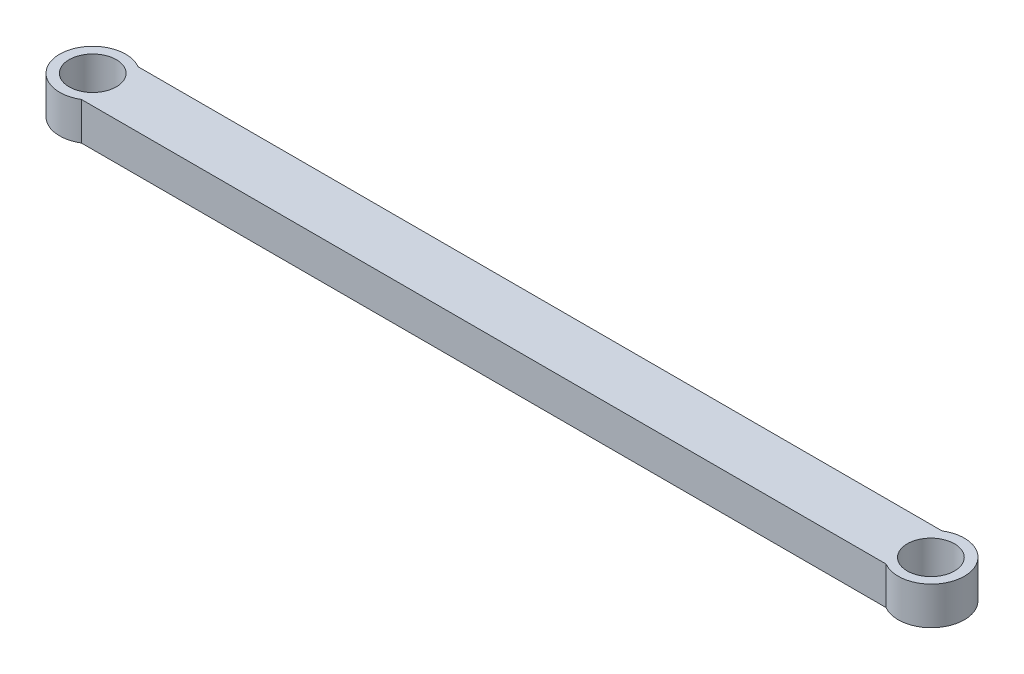
from build123d import *

# Parameters (mm, degrees)
BOSS_EXTRUDE1_DEPTH = 2


with BuildPart() as part:
    # Sketch2 → Boss-Extrude1 (new body)
    with BuildSketch(Plane(origin=(0, 0, 0), x_dir=(1, 0, 0), z_dir=(0, 1, 0))):
        with BuildLine():
            Line((43.464851994, 1.5), (0.901387819, 1.5))
            ThreePointArc((0.901387819, 1.5), (1.523142916, 0.861705088), (1.75, 0))
            ThreePointArc((1.75, 0), (1.523142916, -0.861705088), (0.901387819, -1.5))
            Line((0.901387819, -1.5), (43.499845541, -1.5))
            ThreePointArc((43.499845541, -1.5), (42.633624493, -0.009899958), (43.464851994, 1.5))
        make_face()
        with BuildLine():
            Line((0.901387819, 1.5), (0, 1.5))
            Line((0, 1.5), (0, 1.25))
            ThreePointArc((0, 1.25), (0.883883476, 0.883883476), (1.25, 0))
            ThreePointArc((1.25, 0), (0.883883476, -0.883883476), (0, -1.25))
            Line((0, -1.25), (0, -1.5))
            Line((0, -1.5), (0.901387819, -1.5))
            ThreePointArc((0.901387819, -1.5), (1.523142916, -0.861705088), (1.75, 0))
            ThreePointArc((1.75, 0), (1.523142916, 0.861705088), (0.901387819, 1.5))
        make_face()
        with BuildLine():
            Line((0, 1.5), (0, 1.75))
            ThreePointArc((0, 1.75), (-1.75, 0), (0, -1.75))
            Line((0, -1.75), (0, -1.5))
            Line((0, -1.5), (0, -1.25))
            ThreePointArc((0, -1.25), (-1.25, 0), (0, 1.25))
            Line((0, 1.25), (0, 1.5))
        make_face()
        with BuildLine():
            Line((44.383505452, 1.760511556), (44.383505452, 1.5))
            Line((44.383505452, 1.5), (44.383505452, 1.239488444))
            ThreePointArc((44.383505452, 1.239488444), (45.267388929, 0.87337192), (45.633505452, -0.010511556))
            ThreePointArc((45.633505452, -0.010511556), (45.267388929, -0.894395033), (44.383505452, -1.260511556))
            Line((44.383505452, -1.260511556), (44.383505452, -1.5))
            Line((44.383505452, -1.5), (44.383505452, -1.739488444))
            ThreePointArc((44.383505452, -1.739488444), (45.620942319, -1.226925311), (46.133505452, 0.010511556))
            ThreePointArc((46.133505452, 0.010511556), (45.620942319, 1.247948423), (44.383505452, 1.760511556))
        make_face()
        with BuildLine():
            Line((44.383505452, 1.5), (43.464851994, 1.5))
            ThreePointArc((43.464851994, 1.5), (42.633624493, -0.009899958), (43.499845541, -1.5))
            Line((43.499845541, -1.5), (44.383505452, -1.5))
            Line((44.383505452, -1.5), (44.383505452, -1.260511556))
            ThreePointArc((44.383505452, -1.260511556), (43.133505452, -0.010511556), (44.383505452, 1.239488444))
            Line((44.383505452, 1.239488444), (44.383505452, 1.5))
        make_face()
        with BuildLine():
            ThreePointArc((0.901387819, 1.5), (0.467707173, 1.686342195), (0, 1.75))
            Line((0, 1.75), (0, 1.5))
            Line((0, 1.5), (0.901387819, 1.5))
        make_face()
        with BuildLine():
            Line((0, -1.5), (0, -1.75))
            ThreePointArc((0, -1.75), (0.467707173, -1.686342195), (0.901387819, -1.5))
            Line((0.901387819, -1.5), (0, -1.5))
        make_face()
        with BuildLine():
            ThreePointArc((44.383505452, 1.760511556), (43.906066857, 1.694124454), (43.464851994, 1.5))
            Line((43.464851994, 1.5), (44.383505452, 1.5))
            Line((44.383505452, 1.5), (44.383505452, 1.760511556))
        make_face()
        with BuildLine():
            Line((44.383505452, -1.5), (43.499845541, -1.5))
            ThreePointArc((43.499845541, -1.5), (43.925736528, -1.678555527), (44.383505452, -1.739488444))
            Line((44.383505452, -1.739488444), (44.383505452, -1.5))
        make_face()
    extrude(amount=BOSS_EXTRUDE1_DEPTH)


solid = part.part
